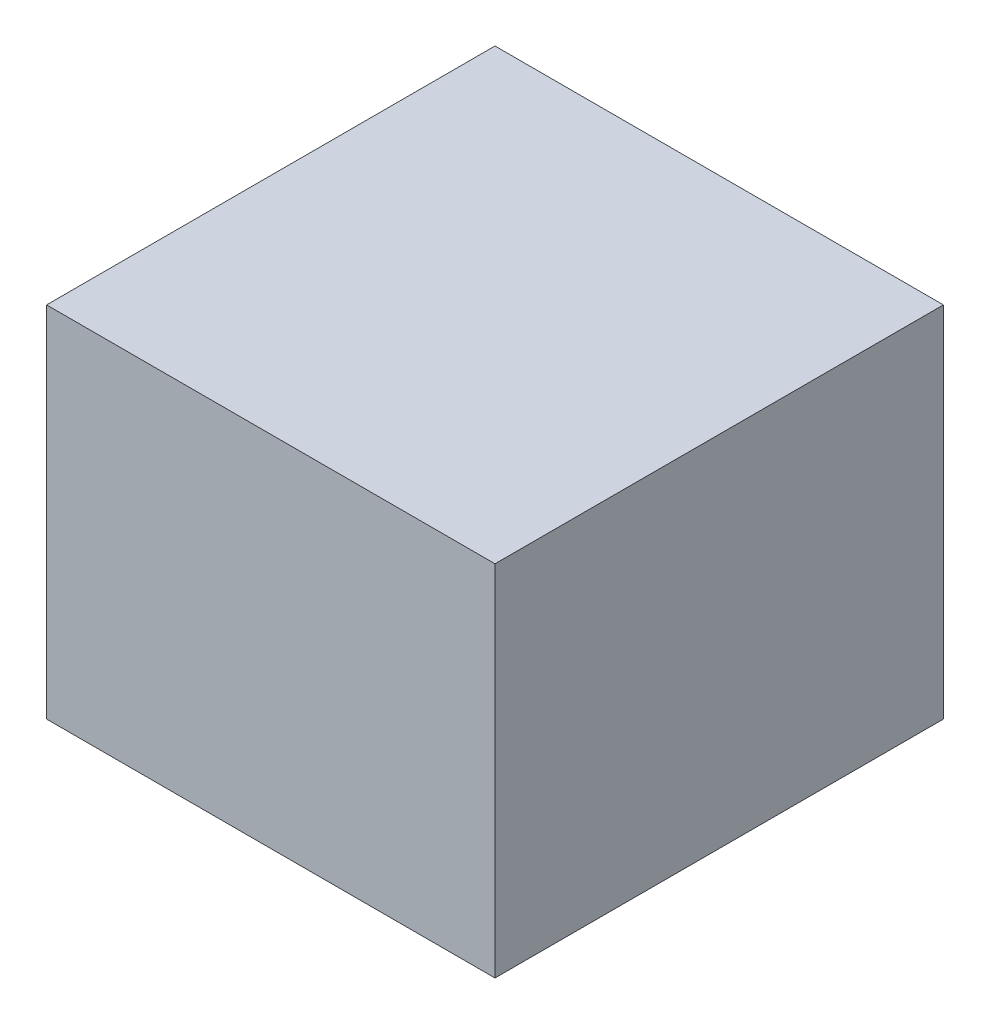
from build123d import *

# Parameters (mm, degrees)
SKETCH1_W           = 254
SKETCH1_H           = 254
BOSS_EXTRUDE1_DEPTH = 203.2


with BuildPart() as part:
    # Sketch1 → Boss-Extrude1 (new body)
    with BuildSketch(Plane(origin=(0, 0, 0), x_dir=(1, 0, 0), z_dir=(0, 1, 0))):
        Rectangle(SKETCH1_W, SKETCH1_H)
    extrude(amount=BOSS_EXTRUDE1_DEPTH)


solid = part.part
